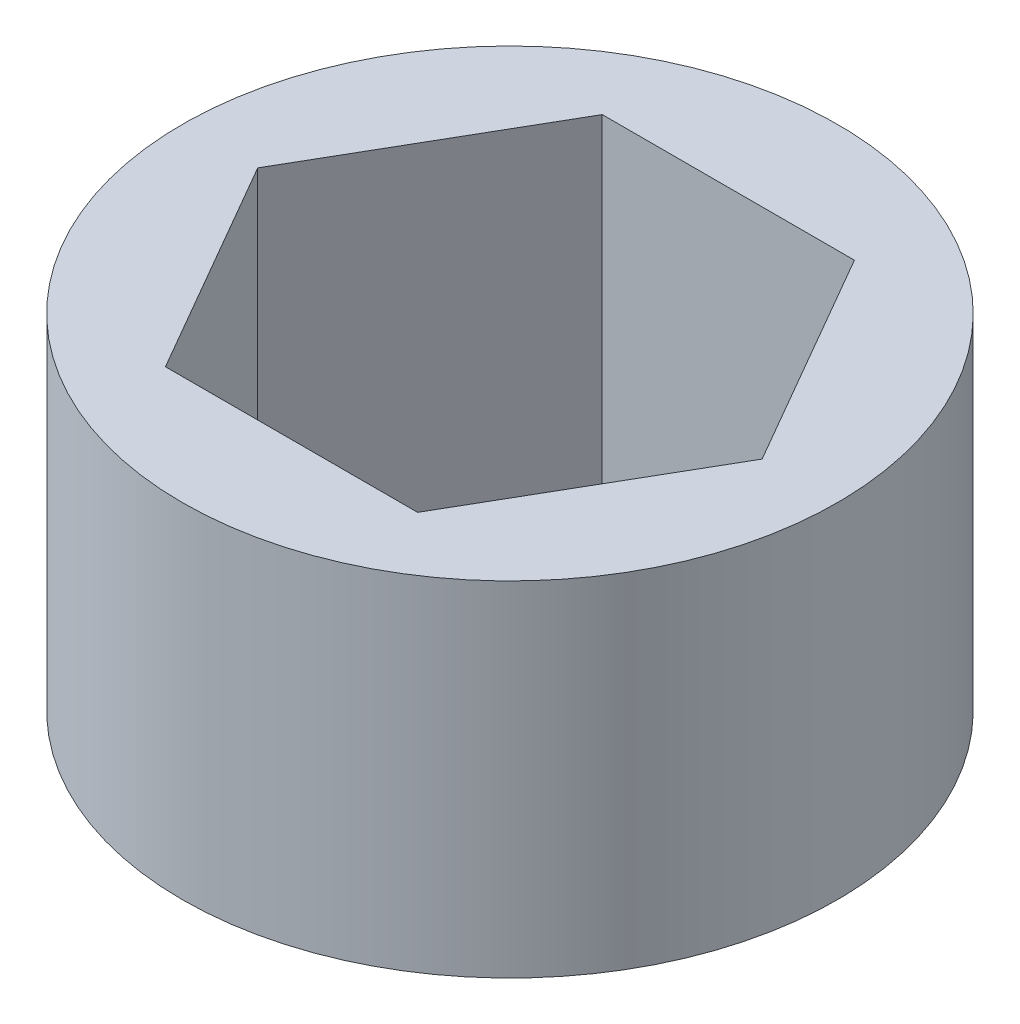
from build123d import *

# Parameters (mm, degrees)
CROQUIS1_R              = 9.525
SALIENTE_EXTRUIR1_DEPTH = 10


with BuildPart() as part:
    # Croquis1 → Saliente-Extruir1 (new body)
    with BuildSketch(Plane(origin=(0, 0, 0), x_dir=(1, 0, 0), z_dir=(0, 1, 0))):
        with Locations(Location((0, 0, 0), (0, 0, 270))):
            Circle(CROQUIS1_R)
        Polygon((7.332348419, 0), (3.666174209, 6.35), (-3.666174209, 6.35), (-7.332348419, 0), (-3.666174209, -6.35), (3.666174209, -6.35), align=None, mode=Mode.SUBTRACT)
    extrude(amount=SALIENTE_EXTRUIR1_DEPTH)


solid = part.part
